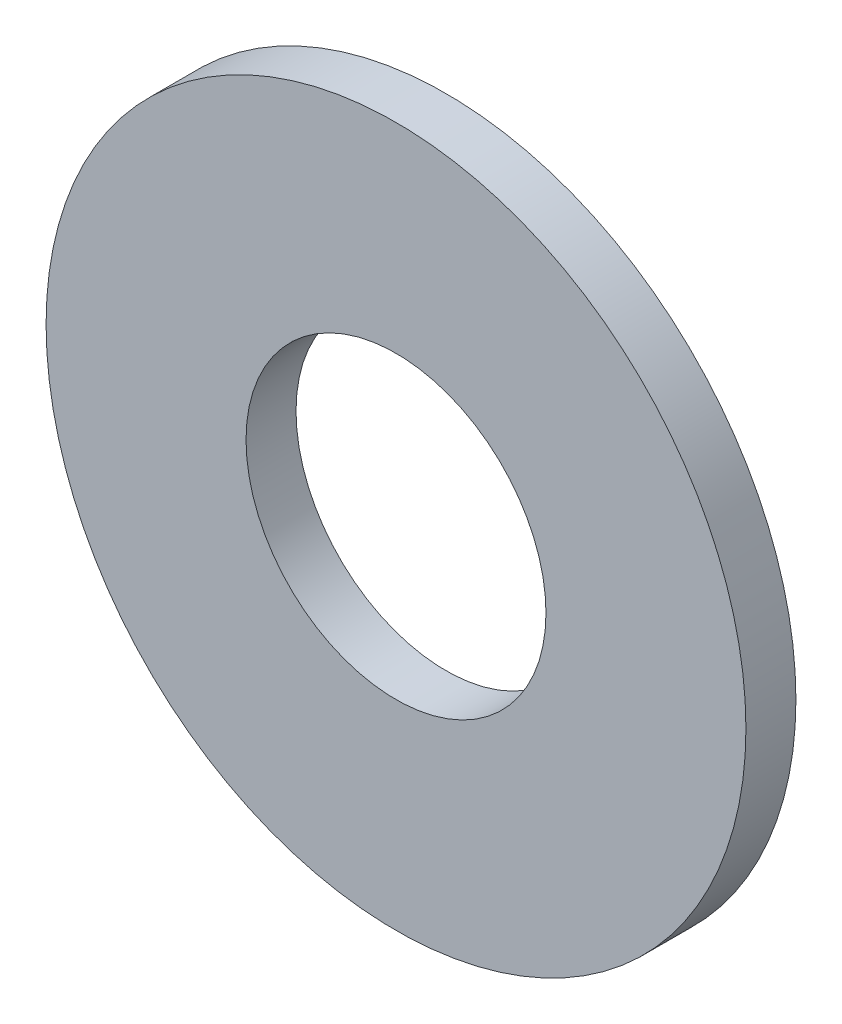
from build123d import *

# Parameters (mm, degrees)
ESQUISSE1_R        = 7
ESQUISSE1_R_2      = 3
BOSS_EXTRU_1_DEPTH = 1


with BuildPart() as part:
    # Esquisse1 → Boss.-Extru.1 (new body)
    with BuildSketch(Plane.XY):
        Circle(ESQUISSE1_R)
        Circle(ESQUISSE1_R_2, mode=Mode.SUBTRACT)
    extrude(amount=BOSS_EXTRU_1_DEPTH)


solid = part.part
